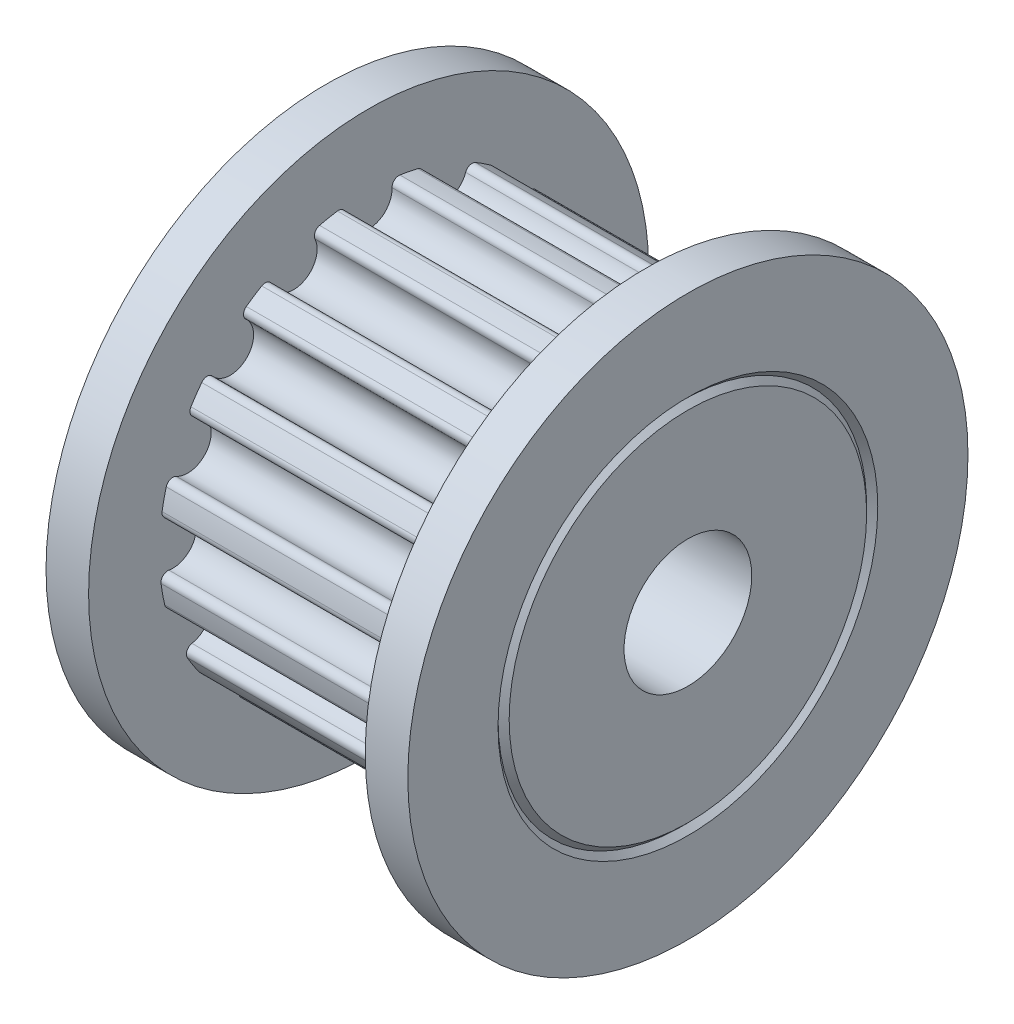
from build123d import *

# Parameters (mm, degrees)
SKETCH_2_R            = 1.5
BORE_DEPTH            = 13.645236257
SKETCH_3_R            = 0.55
CUT_EXTRUDE_16T_DEPTH = 6.5
FILLET_2_R            = 0.16


with BuildPart() as part:
    # Эскиз1 → Body (revolve)
    with BuildSketch(Plane.XY, mode=Mode.PRIVATE) as body_sk:
        Polygon((5.730653245, 4.25), (5.6, 4.119346755), (5.6, -0.08), (14.1, -0.08), (14.1, 4.119346755), (13.969346755, 4.25), (14.1, 4.380653245), (14.1, 6.5), (13.1, 6.5), (13.1, 4.84), (6.6, 4.84), (6.6, 6.5), (5.6, 6.5), (5.6, 4.380653245), align=None)
    revolve(body_sk.sketch.rotate(Axis((5.6, -0.08, 0), (1, 0, 0)), 90), axis=Axis((5.6, -0.08, 0), (1, 0, 0)))

    # Эскиз2 → Bore (cut, through all)
    with BuildSketch(Plane(origin=(14.1, 0, 0), x_dir=(0, 0, -1), z_dir=(1, 0, 0))):
        Circle(SKETCH_2_R)
    extrude(amount=-BORE_DEPTH, mode=Mode.SUBTRACT)

    # Эскиз3 → 16t (cut)
    with BuildSketch(Plane(origin=(6.6, 0, 0), x_dir=(0, 0, -1), z_dir=(1, 0, 0))):
        with Locations((4.24984585, -1.760343789)):
            Circle(SKETCH_3_R)
        with Locations((3.252691193, -3.252691193)):
            Circle(SKETCH_3_R)
        with Locations((1.760343789, -4.24984585)):
            Circle(SKETCH_3_R)
        with Locations((0, -4.6)):
            Circle(SKETCH_3_R)
        with Locations((-1.760343789, -4.24984585)):
            Circle(SKETCH_3_R)
        with Locations((4.6, 0)):
            Circle(SKETCH_3_R)
        with Locations((-3.252691193, -3.252691193)):
            Circle(SKETCH_3_R)
        with Locations((-4.24984585, -1.760343789)):
            Circle(SKETCH_3_R)
        with Locations((-4.6, 0)):
            Circle(SKETCH_3_R)
        with Locations((-4.24984585, 1.760343789)):
            Circle(SKETCH_3_R)
        with Locations((-3.252691193, 3.252691193)):
            Circle(SKETCH_3_R)
        with Locations((-1.760343789, 4.24984585)):
            Circle(SKETCH_3_R)
        with Locations((0, 4.6)):
            Circle(SKETCH_3_R)
        with Locations((1.760343789, 4.24984585)):
            Circle(SKETCH_3_R)
        with Locations((3.252691193, 3.252691193)):
            Circle(SKETCH_3_R)
        with Locations((4.24984585, 1.760343789)):
            Circle(SKETCH_3_R)
    extrude(amount=CUT_EXTRUDE_16T_DEPTH, mode=Mode.SUBTRACT)

    # Fillet 2
    fillet_2_edges = [part.edges().sort_by_distance(p)[0] for p in [
        (9.85, -1.472850774, 4.718725116),
        (9.85, -2.290751829, 4.395335749),
        (9.85, 0.467691918, 4.889420575),
        (9.85, -0.457345331, 4.90550818),
        (9.85, 2.307896944, 4.30166807),
        (9.85, 1.423513661, 4.684639439),
        (9.85, 3.76935603, 3.06412437),
        (9.85, 3.076731176, 3.773784345),
        (9.85, 4.643574473, 1.376315442),
        (9.85, 4.263908655, 2.310163975),
        (9.85, 4.81383547, -0.506729111),
        (9.85, 4.81383547, 0.506729111),
        (9.85, 4.263908655, -2.310163975),
        (9.85, 4.643574473, -1.376315442),
        (9.85, 3.076731176, -3.773784345),
        (9.85, 3.76935603, -3.06412437),
        (9.85, 1.423513661, -4.684639439),
        (9.85, 2.307896944, -4.30166807),
        (9.85, -2.290751829, -4.395335749),
        (9.85, -1.472850774, -4.718725116),
        (9.85, -3.801601506, -3.218086734),
        (9.85, -3.204431031, -3.80056979),
        (9.85, -4.753203917, -1.538689427),
        (9.85, -4.442087214, -2.275652685),
        (9.85, -4.984236726, 0.393525271),
        (9.85, -4.984236726, -0.393525271),
        (9.85, -4.442087214, 2.275652685),
        (9.85, -4.753203917, 1.538689427),
        (9.85, -0.457345331, -4.90550818),
        (9.85, 0.467691918, -4.889420575),
        (9.85, -3.204431031, 3.80056979),
        (9.85, -3.801601506, 3.218086734),
    ]]
    fillet(fillet_2_edges, radius=FILLET_2_R)


solid = part.part
